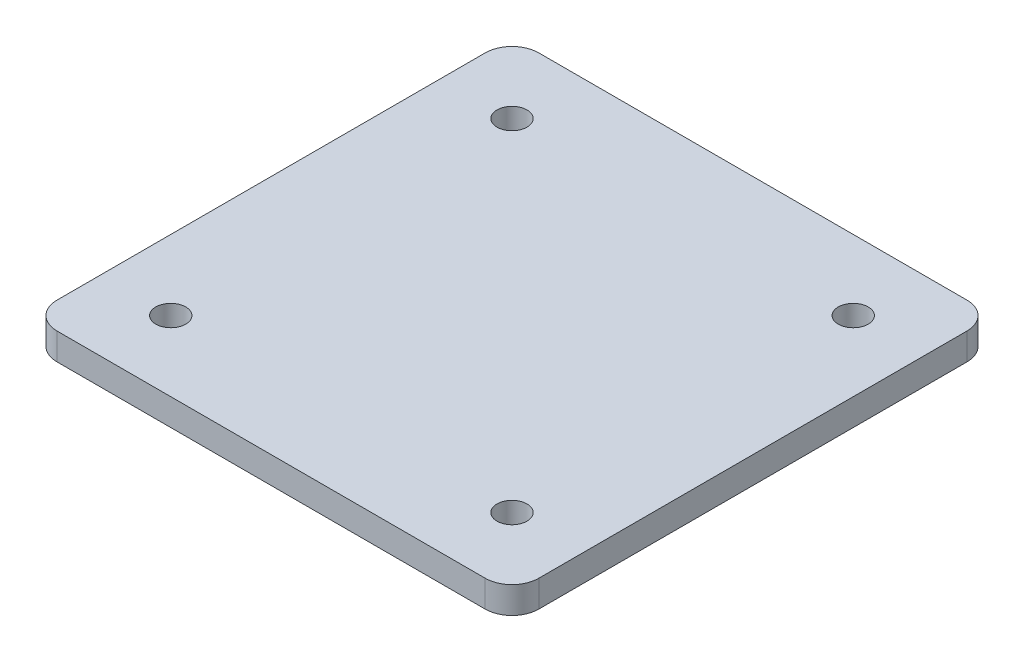
from build123d import *

# Parameters (mm, degrees)
SKETCH_1_W      = 36
SKETCH_1_H      = 36
SKETCH_1_R      = 1.118938203
EXTRUDE_1_DEPTH = 2
FILLET_1_R      = 2


with BuildPart() as part:
    # 草图1 → 凸台-拉伸1 (new body)
    with BuildSketch(Plane(origin=(0, 0, 0), x_dir=(1, 0, 0), z_dir=(0, 1, 0))):
        Rectangle(SKETCH_1_W, SKETCH_1_H)
        with Locations(Location((-12.75, 12.75, 0), (0, 0, 270))):
            Circle(SKETCH_1_R, mode=Mode.SUBTRACT)
        with Locations(Location((12.75, 12.75, 0), (0, 0, 90))):
            Circle(SKETCH_1_R, mode=Mode.SUBTRACT)
        with Locations(Location((12.75, -12.75, 0), (0, 0, 270))):
            Circle(SKETCH_1_R, mode=Mode.SUBTRACT)
        with Locations(Location((-12.75, -12.75, 0), (0, 0, 90))):
            Circle(SKETCH_1_R, mode=Mode.SUBTRACT)
    extrude(amount=EXTRUDE_1_DEPTH)

    # 圆角1
    fillet_1_edges = [part.edges().sort_by_distance(p)[0] for p in [
        (18, 1, 18),
        (-18, 1, 18),
        (-18, 1, -18),
        (18, 1, -18),
    ]]
    fillet(fillet_1_edges, radius=FILLET_1_R)


solid = part.part
